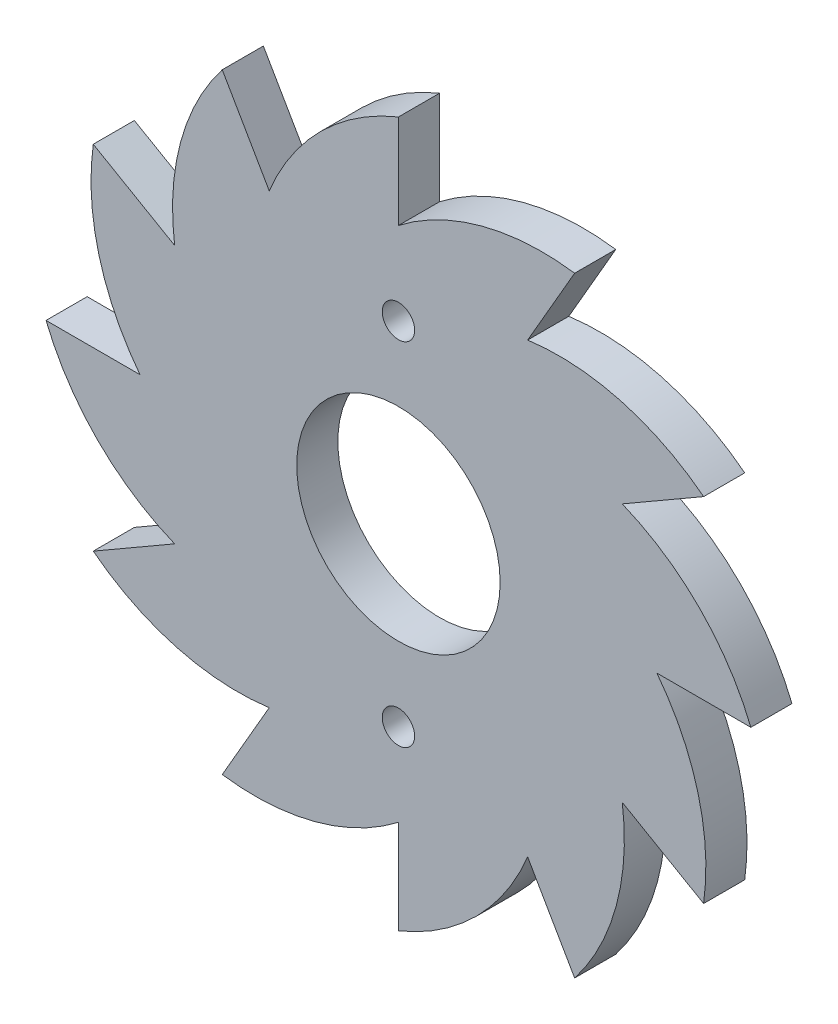
from build123d import *

# Parameters (mm, degrees)
SKETCH1_R           = 38.1
SKETCH1_R_2         = 1.7526
SKETCH1_R_3         = 10.9982
BOSS_EXTRUDE1_DEPTH = 4.445
CUT_EXTRUDE1_DEPTH  = 55.064572735
CIRPATTERN1_COUNT   = 12


with BuildPart() as part:
    # Sketch1 → Boss-Extrude1 (new body)
    with BuildSketch(Plane.XY):
        Circle(SKETCH1_R)
        with Locations((0, 18.9992)):
            Circle(SKETCH1_R_2, mode=Mode.SUBTRACT)
        Circle(SKETCH1_R_3, mode=Mode.SUBTRACT)
        with Locations((0, -18.9992)):
            Circle(SKETCH1_R_2, mode=Mode.SUBTRACT)
    extrude(amount=BOSS_EXTRUDE1_DEPTH)

    # Sketch3 → Cut-Extrude1 (cut, through all)
    with BuildSketch(Plane.XY.offset(4.445)):
        with BuildLine():
            Line((-19.05, 32.995567884), (-13.97, 24.196749782))
            ThreePointArc((-13.97, 24.196749782), (-8.388518849, 32.558632061), (0, 38.1))
            ThreePointArc((0, 38.1), (-9.861005618, 36.801773982), (-19.05, 32.995567884))
        make_face()
    cut_extrude1 = extrude(amount=-CUT_EXTRUDE1_DEPTH, mode=Mode.SUBTRACT)

    # CirPattern1: Cut-Extrude1 ×12 about axis
    cirpattern1_axis = Axis((0, 0, 0), (0, 0, 1))
    for i in range(1, CIRPATTERN1_COUNT):
        add(cut_extrude1.rotate(cirpattern1_axis, i * 360 / CIRPATTERN1_COUNT), mode=Mode.SUBTRACT)


solid = part.part
